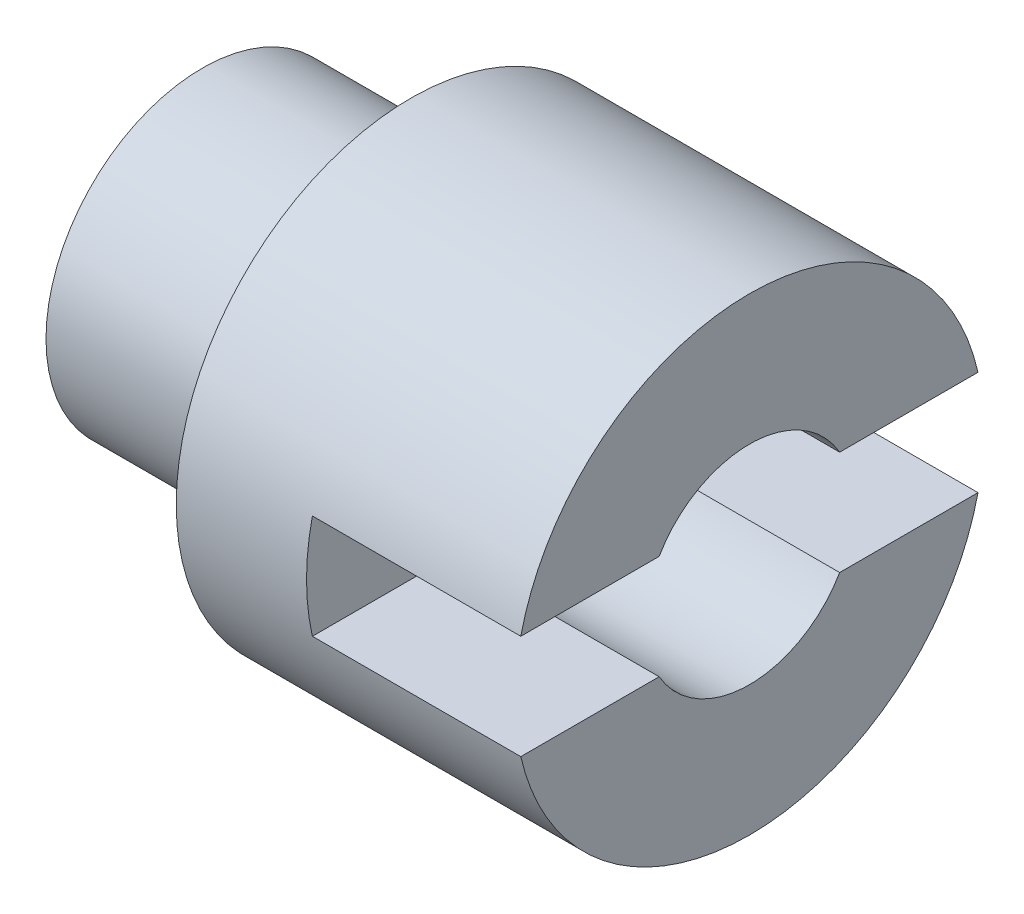
from build123d import *

# Parameters (mm, degrees)
SKETCH_1_R          = 4.5
SKETCH_1_R_2        = 2
EXTRUDE_1_DEPTH     = 4
SKETCH_2_W          = 10.852293239
SKETCH_2_H          = 2
CUT_EXTRUDE_1_DEPTH = 4
SKETCH_5_R          = 4.5
EXTRUDE_3_DEPTH     = 2.5
SKETCH_6_R          = 3
EXTRUDE_4_DEPTH     = 4
SKETCH_7_R          = 0.98
CUT_EXTRUDE_2_DEPTH = 13.278029158


with BuildPart() as part:
    # 草图1 → 凸台-拉伸1 (new body)
    with BuildSketch(Plane(origin=(0, 0, 0), x_dir=(0, 0, -1), z_dir=(1, 0, 0))):
        Circle(SKETCH_1_R)
        Circle(SKETCH_1_R_2, mode=Mode.SUBTRACT)
    extrude(amount=EXTRUDE_1_DEPTH)

    # 草图2 → 切除-拉伸1 (cut)
    with BuildSketch(Plane(origin=(4, 0, 0), x_dir=(0, 0, -1), z_dir=(1, 0, 0))):
        with Locations((-0.118295573, 0)):
            Rectangle(SKETCH_2_W, SKETCH_2_H)
    extrude(amount=-CUT_EXTRUDE_1_DEPTH, mode=Mode.SUBTRACT)


with BuildPart() as cut_extrude_1_piece_1:
    # of the separate pieces the step leaves, piece 1, a body of its own (cut_extrude_1_pieces)
    add(part.part.solids().sort_by_distance((0, 1, -4.387482194))[0])



with BuildPart() as cut_extrude_1_piece_2:
    # of the separate pieces the step leaves, piece 2, a body of its own (cut_extrude_1_pieces)
    add(part.part.solids().sort_by_distance((0, -1, 4.387482194))[0])


with BuildPart() as cut_extrude_1_piece_1_1:
    add(cut_extrude_1_piece_1.part)

    add(cut_extrude_1_piece_2.part)  # 凸台-拉伸3 merges 切除-拉伸1 piece 2
    # 草图5 → 凸台-拉伸3 (add)
    with BuildSketch(Plane.ZY):
        Circle(SKETCH_5_R)
    extrude(amount=EXTRUDE_3_DEPTH)

    # 草图6 → 凸台-拉伸4 (add)
    with BuildSketch(Plane.ZY.offset(2.5)):
        Circle(SKETCH_6_R)
    extrude(amount=EXTRUDE_4_DEPTH)

    # 草图7 → 切除-拉伸2 (cut, through all)
    with BuildSketch(Plane.ZY.offset(6.5)):
        Circle(SKETCH_7_R)
    extrude(amount=-CUT_EXTRUDE_2_DEPTH, mode=Mode.SUBTRACT)


solid = cut_extrude_1_piece_1_1.part
